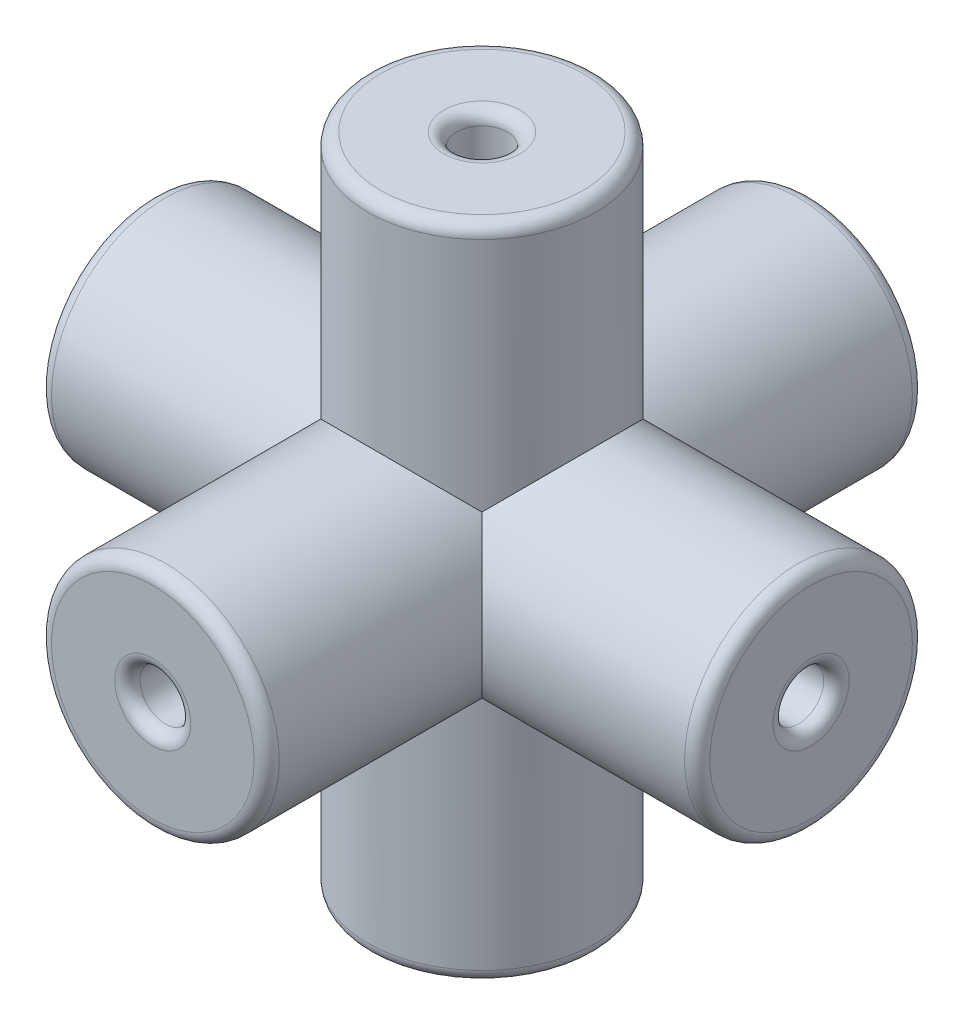
from build123d import *

# Parameters (mm, degrees)
SKETCH2_R             = 4.5
BOSS_EXTRUDE4_DEPTH   = 13
SKETCH6_R             = 4.5
BOSS_EXTRUDE5_DEPTH   = 13
SKETCH7_R             = 4.5
BOSS_EXTRUDE6_DEPTH   = 13
F_2_0MM_DOWEL_HOLE1_D = 2
F_2_0MM_DOWEL_HOLE2_D = 2
F_2_0MM_DOWEL_HOLE3_D = 2
FILLET1_R             = 0.5


with BuildPart() as part:
    # Sketch2 → Boss-Extrude4 (new, symmetric)
    with BuildSketch(Plane.XY):
        with Locations(Location((0, 0, 0), (0, 0, 180))):
            Circle(SKETCH2_R)
    extrude(amount=BOSS_EXTRUDE4_DEPTH, both=True)

    # Sketch6 → Boss-Extrude5 (add, symmetric)
    with BuildSketch(Plane(origin=(0, 0, 0), x_dir=(1, 0, 0), z_dir=(0, 1, 0))):
        Circle(SKETCH6_R)
    extrude(amount=BOSS_EXTRUDE5_DEPTH, both=True)

    # Sketch7 → Boss-Extrude6 (add, symmetric)
    with BuildSketch(Plane(origin=(0, 0, 0), x_dir=(0, 0, -1), z_dir=(1, 0, 0))):
        with Locations(Location((0, 0, 0), (0, 0, 225))):
            Circle(SKETCH7_R)
    extrude(amount=BOSS_EXTRUDE6_DEPTH, both=True)

    # Ø2.0mm Dowel Hole1 (through all)
    with Locations(Plane(origin=(0, 13, 0), x_dir=(1, 0, 0), z_dir=(0, 1, 0))):
        with Locations((0, 0)):
            Hole(F_2_0MM_DOWEL_HOLE1_D / 2)

    # Ø2.0mm Dowel Hole2 (through all)
    with Locations(Plane.ZY.offset(13)):
        with Locations((0, 0)):
            Hole(F_2_0MM_DOWEL_HOLE2_D / 2)

    # Ø2.0mm Dowel Hole3 (through all)
    with Locations(Plane.XY.offset(13)):
        with Locations((0, 0)):
            Hole(F_2_0MM_DOWEL_HOLE3_D / 2)

    # Fillet1
    fillet1_edges = [part.edges().sort_by_distance(p)[0] for p in [
        (4.5, 0, -13),
        (-13, 3.181980515, -3.181980515),
        (13, 3.181980515, -3.181980515),
        (1, 13, 0),
        (1, -13, 0),
        (4.5, 0, 13),
        (13, 0, 1),
        (-13, 0, 1),
        (1, 0, -13),
        (1, 0, 13),
        (-4.5, -13, 0),
        (-4.5, 13, 0),
    ]]
    fillet(fillet1_edges, radius=FILLET1_R)


solid = part.part
